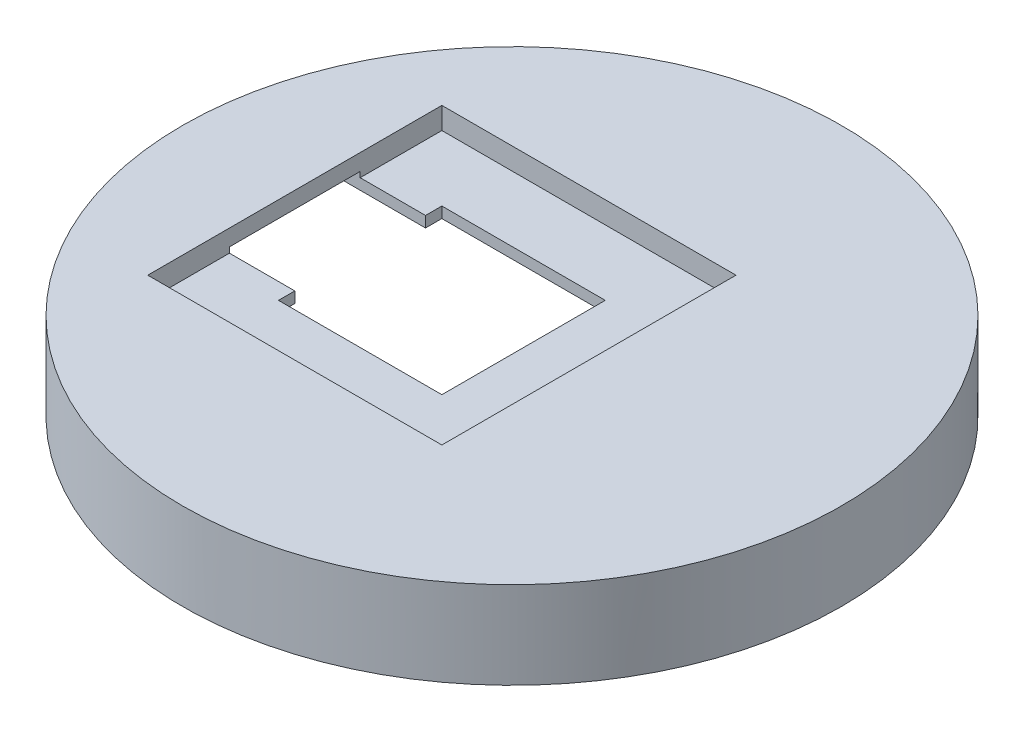
from build123d import *

# Parameters (mm, degrees)
BASE_R                     = 30.25
EXTRUSAO_BASE_DEPTH        = 8
CORTE_BASE_R               = 28.75
EXTRUSAO_CORTE_BASE_DEPTH  = 5
USB_W                      = 142.526664036
USB_H                      = 12
CORTE_USB_DEPTH            = 6.5
CORTE_PRISMA_DEPTH         = 44.521546388
CORTE_PRISMA_DEPTH_BACK    = 44.521546388
PRISMA2_W                  = 15
PRISMA2_H                  = 15
PRISMA_W                   = 27
PRISMA_H                   = 27
CORTE_ENCAIXE_PRISMA_DEPTH = 2


with BuildPart() as part:
    # base → extrusao_base (new body)
    with BuildSketch(Plane(origin=(0, 0, 0), x_dir=(1, 0, 0), z_dir=(0, 1, 0))):
        with Locations(Location((0, 0, 0), (0, 0, 270))):
            Circle(BASE_R)
    extrude(amount=EXTRUSAO_BASE_DEPTH)

    # corte_base → extrusao_corte_base (cut)
    with BuildSketch(Plane(origin=(0, 0, 0), x_dir=(1, 0, 0), z_dir=(0, 1, 0))):
        with Locations(Location((0, 0, 0), (0, 0, 270))):
            Circle(CORTE_BASE_R)
    extrude(amount=EXTRUSAO_CORTE_BASE_DEPTH, mode=Mode.SUBTRACT)

    # usb → corte_usb (cut)
    with BuildSketch(Plane(origin=(0, 0, 0), x_dir=(1, 0, 0), z_dir=(0, 1, 0))):
        with Locations((-71.263332018, 0)):
            Rectangle(USB_W, USB_H)
    extrude(amount=CORTE_USB_DEPTH, mode=Mode.SUBTRACT)

    # prisma2 (on Top Plane) → corte_prisma (cut, two sides: drawn at the far end of the back side and taken through both)
    with BuildSketch(Plane(origin=(0, 0, 0), x_dir=(1, 0, 0), z_dir=(0, 1, 0)).offset(-CORTE_PRISMA_DEPTH_BACK)):
        with Locations((-6.438503074, 0)):
            Rectangle(PRISMA2_W, PRISMA2_H)
    extrude(amount=CORTE_PRISMA_DEPTH + CORTE_PRISMA_DEPTH_BACK, mode=Mode.SUBTRACT)

    # prisma → corte_encaixe_prisma (cut)
    with BuildSketch(Plane(origin=(0, 8, 0), x_dir=(1, 0, 0), z_dir=(0, 1, 0))):
        with Locations((-6.438503074, 0)):
            Rectangle(PRISMA_W, PRISMA_H)
    extrude(amount=-CORTE_ENCAIXE_PRISMA_DEPTH, mode=Mode.SUBTRACT)


solid = part.part
